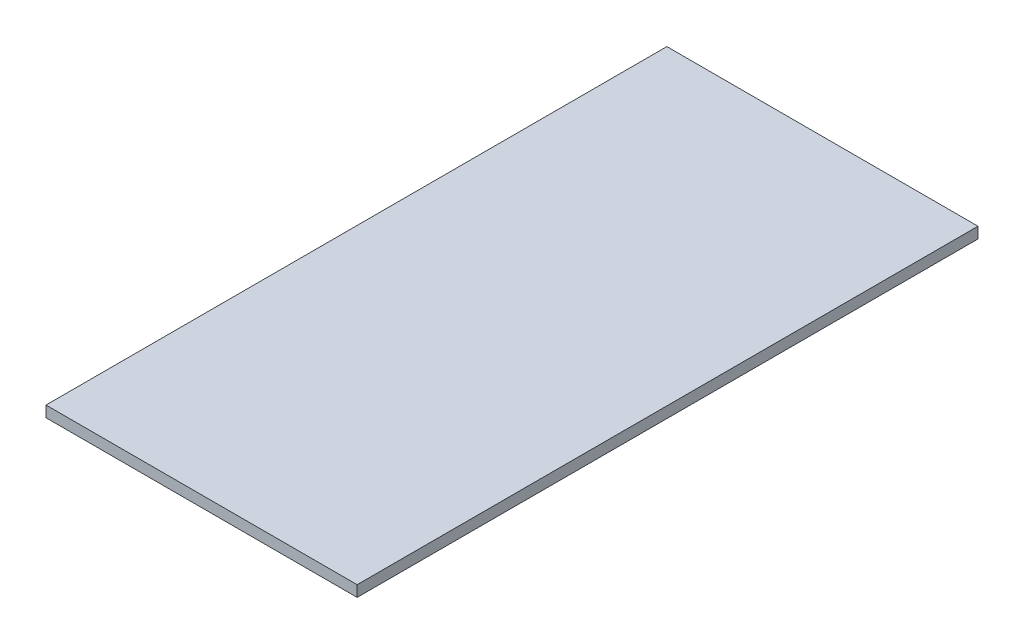
from build123d import *

# Parameters (mm, degrees)
CROQUIS1_W              = 225.51
CROQUIS1_H              = 450
SALIENTE_EXTRUIR1_DEPTH = 4


with BuildPart() as part:
    # Croquis1 → Saliente-Extruir1 (new, symmetric)
    with BuildSketch(Plane(origin=(0, 224.707138557, 0), x_dir=(1, 0, 0), z_dir=(0, 1, 0))):
        with Locations((-32.102036721, -265)):
            Rectangle(CROQUIS1_W, CROQUIS1_H)
    extrude(amount=SALIENTE_EXTRUIR1_DEPTH, both=True)


solid = part.part
